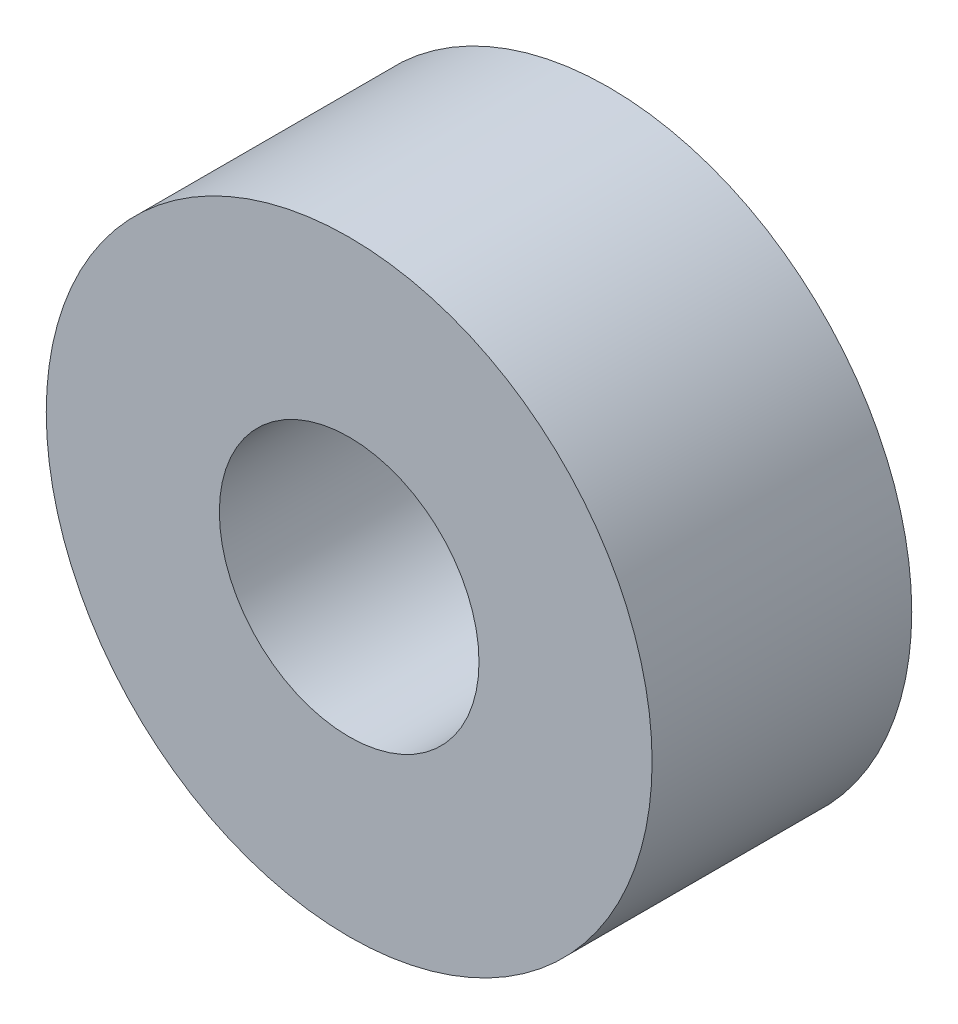
from build123d import *

# Parameters (mm, degrees)
SKETCH1_R           = 11.1125
SKETCH1_R_2         = 4.7625
BOSS_EXTRUDE1_DEPTH = 9.525


with BuildPart() as part:
    # Sketch1 → Boss-Extrude1 (new body)
    with BuildSketch(Plane.XY):
        with Locations(Location((0, 0, 0), (0, 0, 180))):
            Circle(SKETCH1_R)
        with Locations(Location((0, 0, 0), (0, 0, 180))):
            Circle(SKETCH1_R_2, mode=Mode.SUBTRACT)
    extrude(amount=BOSS_EXTRUDE1_DEPTH)


solid = part.part
